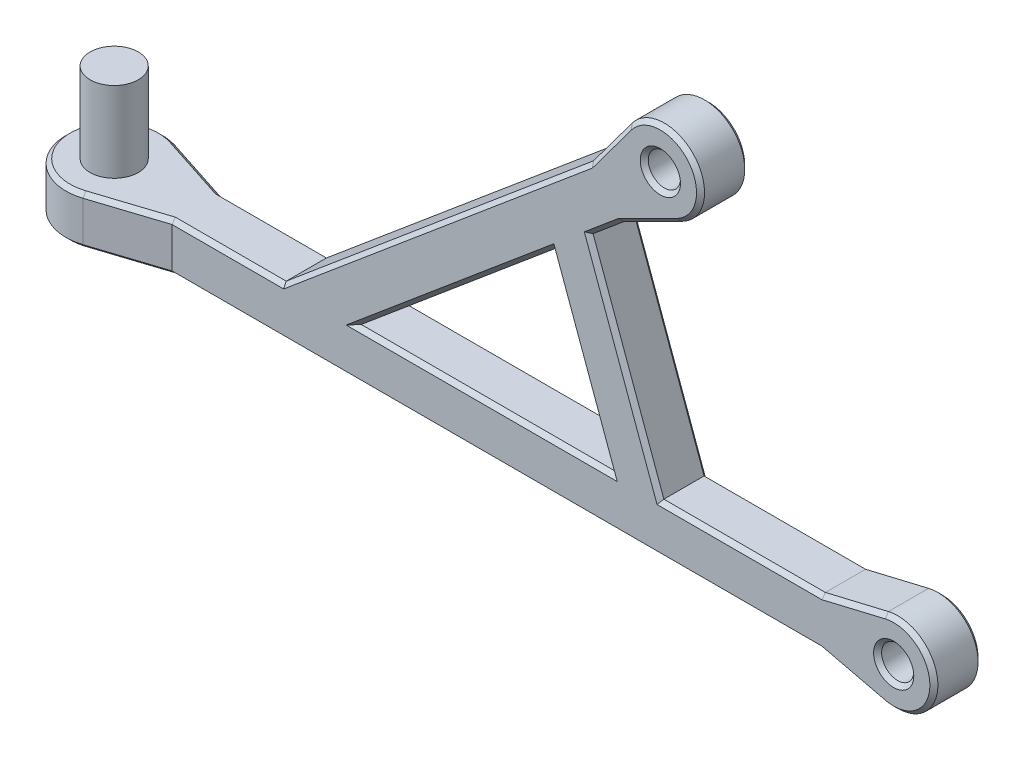
from build123d import *

# Parameters (mm, degrees)
SKETCH_1_R          = 1.5
EXTRUDE_1_DEPTH     = 5
EXTRUDE_2_DEPTH     = 3
EXTRUDE_START       = -1.5
SKETCH_3_R          = 2.5
EXTRUDE_3_DEPTH     = 3
CUT_EXTRUDE_START   = -1.5
SKETCH_4_R          = 1
CUT_EXTRUDE_1_DEPTH = 3
EXTRUDE_4_DEPTH     = 3
EXTRUDE_5_DEPTH     = 3
SKETCH_9_R          = 1
EXTRUDE_6_DEPTH     = 3
EXTRUDE_7_DEPTH     = 3
EXTRUDE_START_2     = 1.5
EXTRUDE_8_DEPTH     = 3
CHAMFER_5_SIZE      = 0.25
CHAMFER_6_SIZE      = 0.25


with BuildPart() as part:
    # 草图1 → 凸台-拉伸1 (new body)
    with BuildSketch(Plane(origin=(0, 0, 0), x_dir=(1, 0, 0), z_dir=(0, 1, 0))):
        with Locations(Location((0, 0, 0), (0, 0, 270))):
            Circle(SKETCH_1_R)
    extrude(amount=EXTRUDE_1_DEPTH)

    # 草图2 → 凸台-拉伸2 (add)
    with BuildSketch(Plane(origin=(0, 0, 0), x_dir=(1, 0, 0), z_dir=(0, 1, 0))):
        with BuildLine():
            Line((50, 1.5), (50, -1.5))
            Line((50, -1.5), (2.598076211, -1.5))
            ThreePointArc((2.598076211, -1.5), (-3, 0), (2.598076211, 1.5))
            Line((2.598076211, 1.5), (50, 1.5))
        make_face()
    extrude(amount=-EXTRUDE_2_DEPTH)

    # 草图3 → 凸台-拉伸3 (add)
    with BuildSketch(Plane.XY.offset(EXTRUDE_START)):
        with Locations((50, -1.5)):
            Circle(SKETCH_3_R)
    extrude(amount=EXTRUDE_3_DEPTH)

    # 草图4 → 切除-拉伸1 (cut)
    with BuildSketch(Plane.XY.offset(CUT_EXTRUDE_START)):
        with Locations(Location((50, -1.5, 0), (0, 0, 180))):
            Circle(SKETCH_4_R)
    extrude(amount=CUT_EXTRUDE_1_DEPTH, mode=Mode.SUBTRACT)

    # 草图5 → 凸台-拉伸4 (add)
    with BuildSketch(Plane(origin=(0, 0, 0), x_dir=(1, 0, 0), z_dir=(0, 1, 0))):
        with BuildLine():
            Line((5.098076211, 1.5), (0.925764755, 2.853587149))
            ThreePointArc((0.925764755, 2.853587149), (1.88743565, 2.331863347), (2.598076211, 1.5))
            Line((2.598076211, 1.5), (5.098076211, 1.5))
        make_face()
        with BuildLine():
            Line((5.098076211, -1.5), (0.925764755, -2.853587149))
            ThreePointArc((0.925764755, -2.853587149), (1.88743565, -2.331863347), (2.598076211, -1.5))
            Line((2.598076211, -1.5), (5.098076211, -1.5))
        make_face()
    extrude(amount=-EXTRUDE_4_DEPTH)

    # 草图6 → 凸台-拉伸5 (add)
    with BuildSketch(Plane.XY.offset(EXTRUDE_START)):
        with BuildLine():
            Line((45.5, 0), (49.421854812, 0.932231104))
            ThreePointArc((49.421854812, 0.932231104), (48.629244055, 0.590700395), (48, 0))
            Line((48, 0), (45.5, 0))
        make_face()
        with BuildLine():
            Line((45.5, -3), (49.421854812, -3.932231104))
            ThreePointArc((49.421854812, -3.932231104), (48.629244055, -3.590700395), (48, -3))
            Line((48, -3), (45.5, -3))
        make_face()
    extrude(amount=EXTRUDE_5_DEPTH)

    # 草图9 → 凸台-拉伸6 (add)
    with BuildSketch(Plane.XY.offset(EXTRUDE_START)):
        with BuildLine():
            Line((16.621216129, 0), (34.913425822, 15.348986407))
            ThreePointArc((34.913425822, 15.348986407), (37.396444401, 19.390597315), (32.985062993, 17.647119736))
            Line((32.985062993, 17.647119736), (11.954044649, 0))
            Line((11.954044649, 0), (16.621216129, 0))
        make_face()
        with Locations(Location((35.481333294, 17.783628291, 0), (0, 0, 180))):
            Circle(SKETCH_9_R, mode=Mode.SUBTRACT)
    extrude(amount=EXTRUDE_6_DEPTH)

    # 草图10 → 凸台-拉伸7 (add)
    with BuildSketch(Plane.XY.offset(EXTRUDE_START)):
        with BuildLine():
            Line((32.998314714, 13.742017382), (36.601856403, 15.548806606))
            ThreePointArc((36.601856403, 15.548806606), (35.775149629, 15.300953934), (34.913425822, 15.348986407))
            Line((34.913425822, 15.348986407), (32.998314714, 13.742017382))
        make_face()
        with BuildLine():
            Line((31.069951885, 16.040150712), (33.475040368, 19.275200849))
            ThreePointArc((33.475040368, 19.275200849), (33.08739701, 18.504092773), (32.985062993, 17.647119736))
            Line((32.985062993, 17.647119736), (31.069951885, 16.040150712))
        make_face()
    extrude(amount=EXTRUDE_7_DEPTH)

    # 草图11 → 凸台-拉伸8 (add)
    with BuildSketch(Plane.XY.offset(EXTRUDE_START_2)):
        Polygon((31.045694114, 12.103574157), (35.451034835, 0), (32.443670675, 0), (28.741919511, 10.170477737), align=None)
    extrude(amount=-EXTRUDE_8_DEPTH)

    # 倒角5
    chamfer_5_edges = [part.edges().sort_by_distance(p)[0] for p in [
        (37.396444401, 19.390597315, 1.5),
        (32.272496126, 17.65767578, -1.5),
        (32.272496126, 17.65767578, 1.5),
        (22.68156782, 5.085238868, 1.5),
        (22.68156782, 5.085238868, -1.5),
        (40.475517418, 0, 1.5),
        (24.532443402, 0, -1.5),
        (30.592795093, 5.085238868, 1.5),
        (33.248364474, 6.051787078, 1.5),
        (30.592795093, 5.085238868, -1.5),
        (33.248364474, 6.051787078, -1.5),
        (51, -1.5, -1.5),
        (51, -1.5, 1.5),
        (8.52606043, 0, 1.5),
        (25.299038106, -3, 1.5),
        (25.299038106, -3, -1.5),
        (47.460927406, -3.466115552, -1.5),
        (47.460927406, -3.466115552, 1.5),
        (52.5, -1.5, -1.5),
        (52.5, -1.5, 1.5),
        (40.475517418, 0, -1.5),
        (47.460927406, 0.466115552, -1.5),
        (47.460927406, 0.466115552, 1.5),
        (8.52606043, 0, -1.5),
        (24.532443402, 0, 1.5),
        (21.511998267, 8.020075356, 1.5),
        (21.511998267, 8.020075356, -1.5),
        (36.481333294, 17.783628291, 1.5),
        (32.022004414, 12.92279577, 1.5),
        (32.022004414, 12.92279577, -1.5),
        (34.800085558, 14.645411994, -1.5),
        (34.800085558, 14.645411994, 1.5),
        (37.396444401, 19.390597315, -1.5),
    ]]
    chamfer(chamfer_5_edges, length=CHAMFER_5_SIZE)

    # 倒角6
    chamfer_6_edges = [part.edges().sort_by_distance(p)[0] for p in [
        (3.397221816, 0, -2.051793575),
        (3.397221816, 0, 2.051793575),
        (-3, 0, 0),
        (3.397221816, -3, -2.051793575),
        (3.397221816, -3, 2.051793575),
        (-3, -3, 0),
    ]]
    chamfer(chamfer_6_edges, length=CHAMFER_6_SIZE)


solid = part.part
